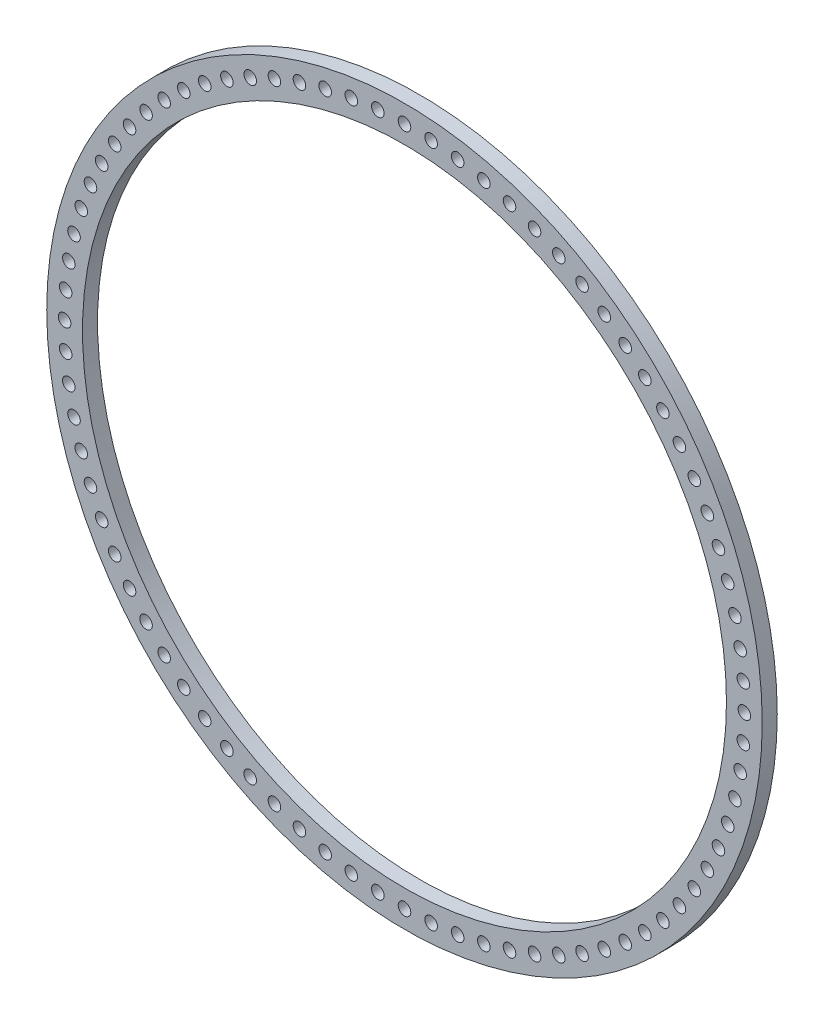
from build123d import *

# Parameters (mm, degrees)
MODEL_R             = 95.25
MODEL_R_2           = 85.725
MODEL_R_3           = 1.6724
BOSS_EXTRUDE1_DEPTH = 4


with BuildPart() as part:
    # Model → Boss-Extrude1 (new body)
    with BuildSketch(Plane.XY):
        Circle(MODEL_R)
        Circle(MODEL_R_2, mode=Mode.SUBTRACT)
        with Locations((90.208557236, -7.099567425)):
            Circle(MODEL_R_3, mode=Mode.SUBTRACT)
        with Locations((89.37344872, -14.155363655)):
            Circle(MODEL_R_3, mode=Mode.SUBTRACT)
        with Locations((87.987323172, -21.123887362)):
            Circle(MODEL_R_3, mode=Mode.SUBTRACT)
        with Locations((86.058726518, -27.962175279)):
            Circle(MODEL_R_3, mode=Mode.SUBTRACT)
        with Locations((83.599549198, -34.628067086)):
            Circle(MODEL_R_3, mode=Mode.SUBTRACT)
        with Locations((80.624952857, -41.080465345)):
            Circle(MODEL_R_3, mode=Mode.SUBTRACT)
        with Locations((77.153276872, -47.279588875)):
            Circle(MODEL_R_3, mode=Mode.SUBTRACT)
        with Locations((73.205925279, -53.187218017)):
            Circle(MODEL_R_3, mode=Mode.SUBTRACT)
        with Locations((68.807234812, -58.766930273)):
            Circle(MODEL_R_3, mode=Mode.SUBTRACT)
        with Locations((63.984324863, -63.984324863)):
            Circle(MODEL_R_3, mode=Mode.SUBTRACT)
        with Locations((58.766930273, -68.807234812)):
            Circle(MODEL_R_3, mode=Mode.SUBTRACT)
        with Locations((53.187218017, -73.205925279)):
            Circle(MODEL_R_3, mode=Mode.SUBTRACT)
        with Locations((47.279588875, -77.153276872)):
            Circle(MODEL_R_3, mode=Mode.SUBTRACT)
        with Locations((41.080465345, -80.624952857)):
            Circle(MODEL_R_3, mode=Mode.SUBTRACT)
        with Locations((34.628067086, -83.599549198)):
            Circle(MODEL_R_3, mode=Mode.SUBTRACT)
        with Locations((27.962175279, -86.058726518)):
            Circle(MODEL_R_3, mode=Mode.SUBTRACT)
        with Locations((21.123887362, -87.987323172)):
            Circle(MODEL_R_3, mode=Mode.SUBTRACT)
        with Locations((14.155363655, -89.37344872)):
            Circle(MODEL_R_3, mode=Mode.SUBTRACT)
        with Locations((7.099567425, -90.208557236)):
            Circle(MODEL_R_3, mode=Mode.SUBTRACT)
        with Locations((0, -90.4875)):
            Circle(MODEL_R_3, mode=Mode.SUBTRACT)
        with Locations((-7.099567425, -90.208557236)):
            Circle(MODEL_R_3, mode=Mode.SUBTRACT)
        with Locations((-14.155363655, -89.37344872)):
            Circle(MODEL_R_3, mode=Mode.SUBTRACT)
        with Locations((-21.123887362, -87.987323172)):
            Circle(MODEL_R_3, mode=Mode.SUBTRACT)
        with Locations((-27.962175279, -86.058726518)):
            Circle(MODEL_R_3, mode=Mode.SUBTRACT)
        with Locations((-34.628067086, -83.599549198)):
            Circle(MODEL_R_3, mode=Mode.SUBTRACT)
        with Locations((-41.080465345, -80.624952857)):
            Circle(MODEL_R_3, mode=Mode.SUBTRACT)
        with Locations((-47.279588875, -77.153276872)):
            Circle(MODEL_R_3, mode=Mode.SUBTRACT)
        with Locations((-53.187218017, -73.205925279)):
            Circle(MODEL_R_3, mode=Mode.SUBTRACT)
        with Locations((-58.766930273, -68.807234812)):
            Circle(MODEL_R_3, mode=Mode.SUBTRACT)
        with Locations((-63.984324863, -63.984324863)):
            Circle(MODEL_R_3, mode=Mode.SUBTRACT)
        with Locations((-68.807234812, -58.766930273)):
            Circle(MODEL_R_3, mode=Mode.SUBTRACT)
        with Locations((-73.205925279, -53.187218017)):
            Circle(MODEL_R_3, mode=Mode.SUBTRACT)
        with Locations((-77.153276872, -47.279588875)):
            Circle(MODEL_R_3, mode=Mode.SUBTRACT)
        with Locations((-80.624952857, -41.080465345)):
            Circle(MODEL_R_3, mode=Mode.SUBTRACT)
        with Locations((-83.599549198, -34.628067086)):
            Circle(MODEL_R_3, mode=Mode.SUBTRACT)
        with Locations((-86.058726518, -27.962175279)):
            Circle(MODEL_R_3, mode=Mode.SUBTRACT)
        with Locations((-87.987323172, -21.123887362)):
            Circle(MODEL_R_3, mode=Mode.SUBTRACT)
        with Locations((-89.37344872, -14.155363655)):
            Circle(MODEL_R_3, mode=Mode.SUBTRACT)
        with Locations((-90.208557236, -7.099567425)):
            Circle(MODEL_R_3, mode=Mode.SUBTRACT)
        with Locations((-90.4875, 0)):
            Circle(MODEL_R_3, mode=Mode.SUBTRACT)
        with Locations((-90.208557236, 7.099567425)):
            Circle(MODEL_R_3, mode=Mode.SUBTRACT)
        with Locations((-89.37344872, 14.155363655)):
            Circle(MODEL_R_3, mode=Mode.SUBTRACT)
        with Locations((-87.987323172, 21.123887362)):
            Circle(MODEL_R_3, mode=Mode.SUBTRACT)
        with Locations((-86.058726518, 27.962175279)):
            Circle(MODEL_R_3, mode=Mode.SUBTRACT)
        with Locations((-83.599549198, 34.628067086)):
            Circle(MODEL_R_3, mode=Mode.SUBTRACT)
        with Locations((-80.624952857, 41.080465345)):
            Circle(MODEL_R_3, mode=Mode.SUBTRACT)
        with Locations((-77.153276872, 47.279588875)):
            Circle(MODEL_R_3, mode=Mode.SUBTRACT)
        with Locations((-73.205925279, 53.187218017)):
            Circle(MODEL_R_3, mode=Mode.SUBTRACT)
        with Locations((-68.807234812, 58.766930273)):
            Circle(MODEL_R_3, mode=Mode.SUBTRACT)
        with Locations((-63.984324863, 63.984324863)):
            Circle(MODEL_R_3, mode=Mode.SUBTRACT)
        with Locations((-58.766930273, 68.807234812)):
            Circle(MODEL_R_3, mode=Mode.SUBTRACT)
        with Locations((-53.187218017, 73.205925279)):
            Circle(MODEL_R_3, mode=Mode.SUBTRACT)
        with Locations((-47.279588875, 77.153276872)):
            Circle(MODEL_R_3, mode=Mode.SUBTRACT)
        with Locations((-41.080465345, 80.624952857)):
            Circle(MODEL_R_3, mode=Mode.SUBTRACT)
        with Locations((-34.628067086, 83.599549198)):
            Circle(MODEL_R_3, mode=Mode.SUBTRACT)
        with Locations((-27.962175279, 86.058726518)):
            Circle(MODEL_R_3, mode=Mode.SUBTRACT)
        with Locations((-21.123887362, 87.987323172)):
            Circle(MODEL_R_3, mode=Mode.SUBTRACT)
        with Locations((-14.155363655, 89.37344872)):
            Circle(MODEL_R_3, mode=Mode.SUBTRACT)
        with Locations((-7.099567425, 90.208557236)):
            Circle(MODEL_R_3, mode=Mode.SUBTRACT)
        with Locations((0, 90.4875)):
            Circle(MODEL_R_3, mode=Mode.SUBTRACT)
        with Locations((7.099567425, 90.208557236)):
            Circle(MODEL_R_3, mode=Mode.SUBTRACT)
        with Locations((14.155363655, 89.37344872)):
            Circle(MODEL_R_3, mode=Mode.SUBTRACT)
        with Locations((21.123887362, 87.987323172)):
            Circle(MODEL_R_3, mode=Mode.SUBTRACT)
        with Locations((27.962175279, 86.058726518)):
            Circle(MODEL_R_3, mode=Mode.SUBTRACT)
        with Locations((34.628067086, 83.599549198)):
            Circle(MODEL_R_3, mode=Mode.SUBTRACT)
        with Locations((41.080465345, 80.624952857)):
            Circle(MODEL_R_3, mode=Mode.SUBTRACT)
        with Locations((47.279588875, 77.153276872)):
            Circle(MODEL_R_3, mode=Mode.SUBTRACT)
        with Locations((53.187218017, 73.205925279)):
            Circle(MODEL_R_3, mode=Mode.SUBTRACT)
        with Locations((58.766930273, 68.807234812)):
            Circle(MODEL_R_3, mode=Mode.SUBTRACT)
        with Locations((63.984324863, 63.984324863)):
            Circle(MODEL_R_3, mode=Mode.SUBTRACT)
        with Locations((68.807234812, 58.766930273)):
            Circle(MODEL_R_3, mode=Mode.SUBTRACT)
        with Locations((73.205925279, 53.187218017)):
            Circle(MODEL_R_3, mode=Mode.SUBTRACT)
        with Locations((77.153276872, 47.279588875)):
            Circle(MODEL_R_3, mode=Mode.SUBTRACT)
        with Locations((80.624952857, 41.080465345)):
            Circle(MODEL_R_3, mode=Mode.SUBTRACT)
        with Locations((83.599549198, 34.628067086)):
            Circle(MODEL_R_3, mode=Mode.SUBTRACT)
        with Locations((86.058726518, 27.962175279)):
            Circle(MODEL_R_3, mode=Mode.SUBTRACT)
        with Locations((87.987323172, 21.123887362)):
            Circle(MODEL_R_3, mode=Mode.SUBTRACT)
        with Locations((89.37344872, 14.155363655)):
            Circle(MODEL_R_3, mode=Mode.SUBTRACT)
        with Locations((90.208557236, 7.099567425)):
            Circle(MODEL_R_3, mode=Mode.SUBTRACT)
        with Locations((90.4875, 0)):
            Circle(MODEL_R_3, mode=Mode.SUBTRACT)
    extrude(amount=BOSS_EXTRUDE1_DEPTH)


solid = part.part
